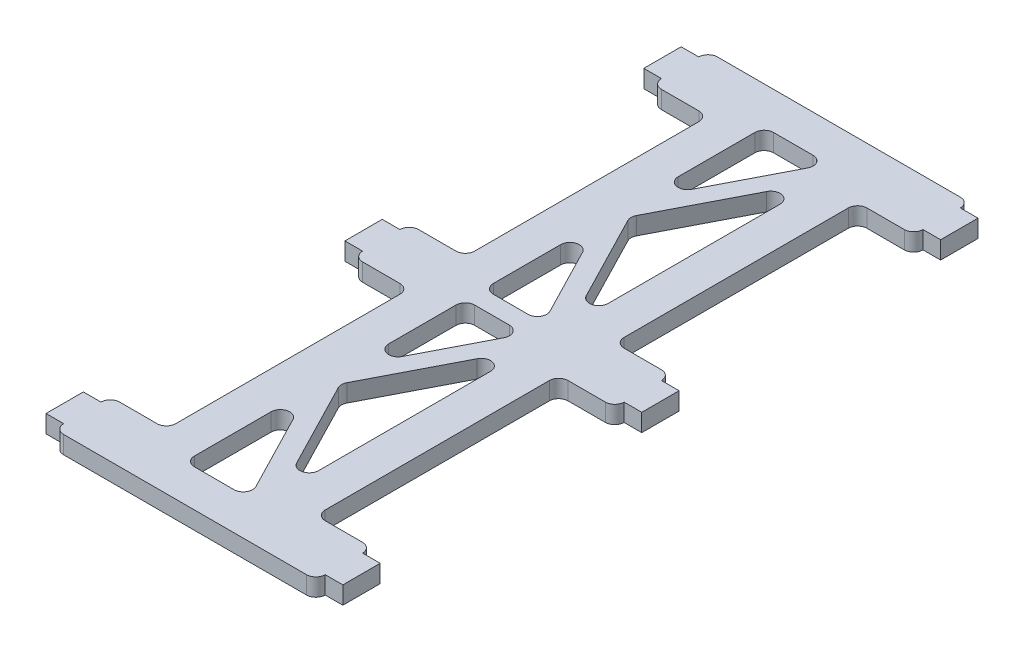
from build123d import *

# Parameters (mm, degrees)
SKETCH1_W           = 25.4
SKETCH1_H           = 111.125
BOSS_EXTRUDE1_DEPTH = 1.5
SKETCH2_W           = 9.525
SKETCH2_H           = 9.525
BOSS_EXTRUDE2_DEPTH = 3
CUT_EXTRUDE1_DEPTH  = 178.633881287
FILLET1_R           = 1.5875
SKETCH5_W           = 3
SKETCH5_H           = 6.35
BOSS_EXTRUDE3_DEPTH = 3


with BuildPart() as part:
    # Sketch1 → Boss-Extrude1 (new, symmetric)
    with BuildSketch(Plane(origin=(0, 34.29, 0), x_dir=(1, 0, 0), z_dir=(0, 1, 0))):
        with Locations((0, 120.65)):
            Rectangle(SKETCH1_W, SKETCH1_H)
    extrude(amount=BOSS_EXTRUDE1_DEPTH, both=True)

    # Sketch2 → Boss-Extrude2 (add)
    with BuildSketch(Plane(origin=(0, 35.79, 0), x_dir=(1, 0, 0), z_dir=(0, 1, 0))):
        with Locations((17.4625, 171.45)):
            Rectangle(SKETCH2_W, SKETCH2_H)
        with Locations((-17.4625, 171.45)):
            Rectangle(SKETCH2_W, SKETCH2_H)
        with Locations((17.4625, 120.65)):
            Rectangle(SKETCH2_W, SKETCH2_H)
        with Locations((-17.4625, 120.65)):
            Rectangle(SKETCH2_W, SKETCH2_H)
        with Locations((17.4625, 69.85)):
            Rectangle(SKETCH2_W, SKETCH2_H)
        with Locations((-17.4625, 69.85)):
            Rectangle(SKETCH2_W, SKETCH2_H)
    extrude(amount=-BOSS_EXTRUDE2_DEPTH)

    # Sketch4 → Cut-Extrude1 (cut, through all)
    with BuildSketch(Plane(origin=(0, 35.79, 0), x_dir=(1, 0, 0), z_dir=(0, 1, 0))):
        Polygon((4.563523411, 71.4375), (-6.35, 92.58245161), (-6.35, 71.4375), align=None)
        Polygon((6.35, 74.89879839), (6.35, 117.18870161), (-4.563523411, 96.04375), align=None)
        Polygon((3.744168573, 119.0625), (-6.35, 119.0625), (-6.35, 99.50504839), align=None)
        Polygon((3.744168573, 122.2375), (-6.35, 141.79495161), (-6.35, 122.2375), align=None)
        Polygon((6.35, 124.11129839), (6.35, 166.40120161), (-4.563523411, 145.25625), align=None)
        Polygon((4.563523411, 169.8625), (-6.35, 169.8625), (-6.35, 148.71754839), align=None)
    extrude(amount=-CUT_EXTRUDE1_DEPTH, mode=Mode.SUBTRACT)

    # Fillet1
    fillet1_edges = [part.edges().sort_by_distance(p)[0] for p in [
        (3.744168573, 34.29, -119.0625),
        (-6.35, 34.29, -99.50504839),
        (-6.35, 34.29, -119.0625),
        (-4.563523411, 34.29, -96.04375),
        (6.35, 34.29, -117.18870161),
        (6.35, 34.29, -74.89879839),
        (-4.563523411, 34.29, -145.25625),
        (6.35, 34.29, -166.40120161),
        (6.35, 34.29, -124.11129839),
        (3.744168573, 34.29, -122.2375),
        (-6.35, 34.29, -122.2375),
        (-6.35, 34.29, -141.79495161),
        (-6.35, 34.29, -148.71754839),
        (-6.35, 34.29, -169.8625),
        (4.563523411, 34.29, -169.8625),
        (4.563523411, 34.29, -71.4375),
        (-6.35, 34.29, -71.4375),
        (-6.35, 34.29, -92.58245161),
        (22.225, 34.29, -65.0875),
        (22.225, 34.29, -74.6125),
        (12.7, 34.29, -74.6125),
        (-12.7, 34.29, -115.8875),
        (-12.7, 34.29, -125.4125),
        (-22.225, 34.29, -125.4125),
        (-22.225, 34.29, -115.8875),
        (22.225, 34.29, -115.8875),
        (22.225, 34.29, -125.4125),
        (12.7, 34.29, -125.4125),
        (12.7, 34.29, -115.8875),
        (-12.7, 34.29, -166.6875),
        (-22.225, 34.29, -176.2125),
        (-22.225, 34.29, -166.6875),
        (-12.7, 34.29, -74.6125),
        (-22.225, 34.29, -74.6125),
        (-22.225, 34.29, -65.0875),
        (22.225, 34.29, -166.6875),
        (22.225, 34.29, -176.2125),
        (12.7, 34.29, -166.6875),
    ]]
    fillet(fillet1_edges, radius=FILLET1_R)

    # Sketch5 → Boss-Extrude3 (add)
    with BuildSketch(Plane(origin=(0, 35.79, 0), x_dir=(1, 0, 0), z_dir=(0, 1, 0))):
        with Locations((23.725, 171.45)):
            Rectangle(SKETCH5_W, SKETCH5_H)
        with Locations((-23.725, 171.45)):
            Rectangle(SKETCH5_W, SKETCH5_H)
        with Locations((23.725, 120.65)):
            Rectangle(SKETCH5_W, SKETCH5_H)
        with Locations((-23.725, 120.65)):
            Rectangle(SKETCH5_W, SKETCH5_H)
        with Locations((23.725, 69.85)):
            Rectangle(SKETCH5_W, SKETCH5_H)
        with Locations((-23.725, 69.85)):
            Rectangle(SKETCH5_W, SKETCH5_H)
    extrude(amount=-BOSS_EXTRUDE3_DEPTH)


solid = part.part
